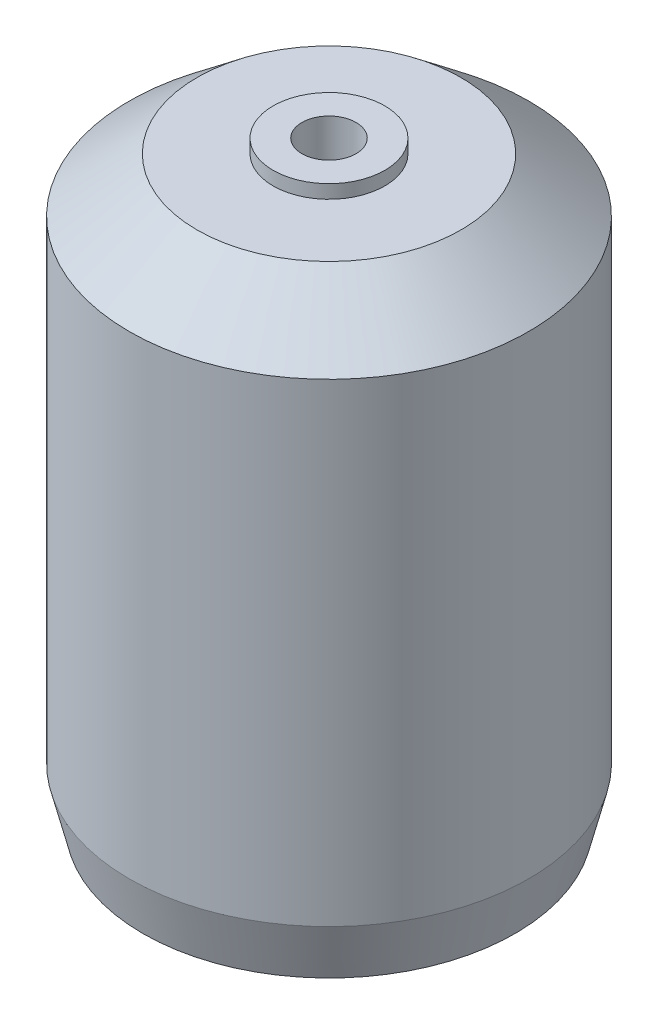
from build123d import *

# Parameters (mm, degrees)
SKETCH1_R           = 29.5
BOSS_EXTRUDE1_DEPTH = 86
CHAMFER1_SIZE       = 8
CHAMFER1_SIZE2      = 10
CHAMFER2_SIZE       = 2
CHAMFER2_SIZE2      = 8
SKETCH3_R           = 8.25
BOSS_EXTRUDE2_DEPTH = 2
SKETCH2_R           = 4
CUT_EXTRUDE1_DEPTH  = 98.388397666


with BuildPart() as part:
    # Sketch1 → Boss-Extrude1 (new body)
    with BuildSketch(Plane(origin=(0, 0, 0), x_dir=(1, 0, 0), z_dir=(0, 1, 0))):
        with Locations(Location((0, 0, 0), (0, 0, 270))):
            Circle(SKETCH1_R)
    extrude(amount=BOSS_EXTRUDE1_DEPTH)

    # Chamfer1
    chamfer1_edges = [part.edges().sort_by_distance(p)[0] for p in [
        (0, 86, -29.5),
    ]]
    chamfer1_side = [part.faces().sort_by_distance(p)[0] for p in [
        (0, 43, -29.5),
    ]]
    chamfer(chamfer1_edges, length=CHAMFER1_SIZE, length2=CHAMFER1_SIZE2, reference=chamfer1_side[0])

    # Chamfer2
    chamfer2_edges = [part.edges().sort_by_distance(p)[0] for p in [
        (0, 0, -29.5),
    ]]
    chamfer2_side = [part.faces().sort_by_distance(p)[0] for p in [
        (0, 0, 0),
    ]]
    chamfer(chamfer2_edges, length=CHAMFER2_SIZE, length2=CHAMFER2_SIZE2, reference=chamfer2_side[0])

    # Sketch3 → Boss-Extrude2 (add)
    with BuildSketch(Plane(origin=(0, 86, 0), x_dir=(1, 0, 0), z_dir=(0, 1, 0))):
        with Locations(Location((0, 0, 0), (0, 0, 270))):
            Circle(SKETCH3_R)
    extrude(amount=BOSS_EXTRUDE2_DEPTH)

    # Sketch2 → Cut-Extrude1 (cut, through all)
    with BuildSketch(Plane.XZ):
        with Locations(Location((0, 0, 0), (0, 0, 270))):
            Circle(SKETCH2_R)
    extrude(amount=-CUT_EXTRUDE1_DEPTH, mode=Mode.SUBTRACT)


solid = part.part
